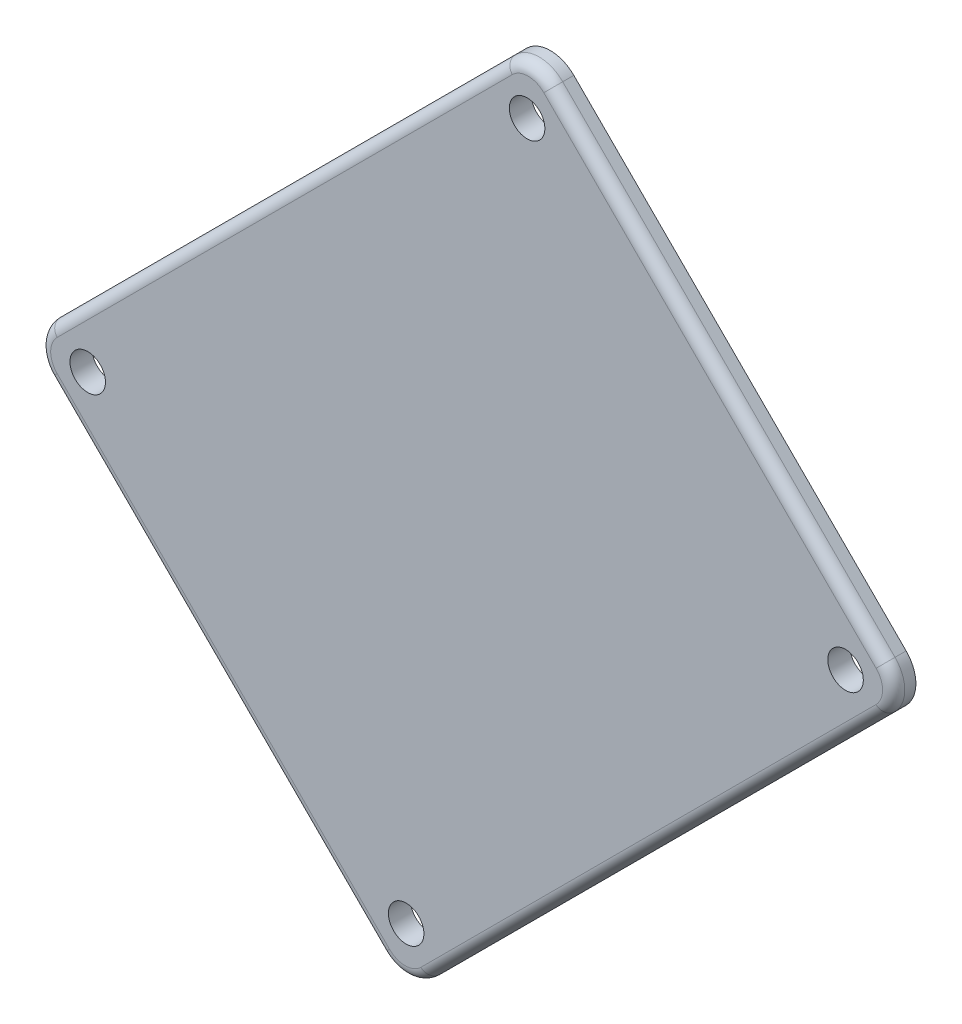
from build123d import *

# Parameters (mm, degrees)
BOSS_EXTRUDE1_DEPTH = 2
CUT_EXTRUDE1_REACH  = 127.814
SKETCH2_R           = 1.6
FILLET1_R           = 1


with BuildPart() as part:
    # Sketch1 → Boss-Extrude1 (new body)
    with BuildSketch(Plane.XY):
        with BuildLine():
            Line((-75.603923459, -58.941906487), (-34.59173015, -17.929713178))
            ThreePointArc((-34.59173015, -17.929713178), (-33.713050494, -15.808392834), (-34.59173015, -13.687072491))
            Line((-34.59173015, -13.687072491), (-64.530631265, 16.251828625))
            ThreePointArc((-64.530631265, 16.251828625), (-66.651951609, 17.130508281), (-68.773271953, 16.251828625))
            Line((-68.773271953, 16.251828625), (-109.785465261, -24.760364684))
            ThreePointArc((-109.785465261, -24.760364684), (-110.664144918, -26.881685028), (-109.785465261, -29.003005371))
            Line((-109.785465261, -29.003005371), (-79.846564146, -58.941906487))
            ThreePointArc((-79.846564146, -58.941906487), (-77.725243802, -59.820586143), (-75.603923459, -58.941906487))
        make_face()
    extrude(amount=BOSS_EXTRUDE1_DEPTH)

    # Sketch2 → Cut-Extrude1 (cut, up to next)
    with BuildSketch(Plane.XY.offset(2), mode=Mode.PRIVATE) as cut_extrude1_sk1:
        with Locations((-106.329000575, -26.794058815)):
            Circle(SKETCH2_R)
    cut_extrude1_tool1 = extrude(cut_extrude1_sk1.sketch, amount=-CUT_EXTRUDE1_REACH, mode=Mode.PRIVATE) & part.part
    # Sketch2 → Cut-Extrude1 (cut, up to next)
    with BuildSketch(Plane.XY.offset(2), mode=Mode.PRIVATE) as cut_extrude1_sk2:
        with Locations(Location((-77.63761759, -55.4854418, 0), (0, 0, 180))):
            Circle(SKETCH2_R)
    cut_extrude1_tool2 = extrude(cut_extrude1_sk2.sketch, amount=-CUT_EXTRUDE1_REACH, mode=Mode.PRIVATE) & part.part
    # Sketch2 → Cut-Extrude1 (cut, up to next)
    with BuildSketch(Plane.XY.offset(2), mode=Mode.PRIVATE) as cut_extrude1_sk3:
        with Locations((-38.048194837, -15.896019047)):
            Circle(SKETCH2_R)
    cut_extrude1_tool3 = extrude(cut_extrude1_sk3.sketch, amount=-CUT_EXTRUDE1_REACH, mode=Mode.PRIVATE) & part.part
    # Sketch2 → Cut-Extrude1 (cut, up to next)
    with BuildSketch(Plane.XY.offset(2), mode=Mode.PRIVATE) as cut_extrude1_sk4:
        with Locations(Location((-66.739577822, 12.795363938, 0), (0, 0, 180))):
            Circle(SKETCH2_R)
    cut_extrude1_tool4 = extrude(cut_extrude1_sk4.sketch, amount=-CUT_EXTRUDE1_REACH, mode=Mode.PRIVATE) & part.part
    add(cut_extrude1_tool1.solids().sort_by_distance((-106.329001, -26.794059, 2))[0], mode=Mode.SUBTRACT)
    add(cut_extrude1_tool2.solids().sort_by_distance((-77.637618, -55.485442, 2))[0], mode=Mode.SUBTRACT)
    add(cut_extrude1_tool3.solids().sort_by_distance((-38.048195, -15.896019, 2))[0], mode=Mode.SUBTRACT)
    add(cut_extrude1_tool4.solids().sort_by_distance((-66.739578, 12.795364, 2))[0], mode=Mode.SUBTRACT)

    # Fillet1
    fillet1_edges = [part.edges().sort_by_distance(p)[0] for p in [
        (-77.725243802, -59.820586143, 2),
        (-55.097826804, -38.435809832, 2),
        (-33.713050494, -15.808392834, 2),
        (-49.561180708, 1.282378067, 2),
        (-66.651951609, 17.130508281, 2),
        (-89.279368607, -4.25426803, 2),
        (-110.664144918, -26.881685028, 2),
        (-94.816014704, -43.972455929, 2),
    ]]
    fillet(fillet1_edges, radius=FILLET1_R)


solid = part.part
